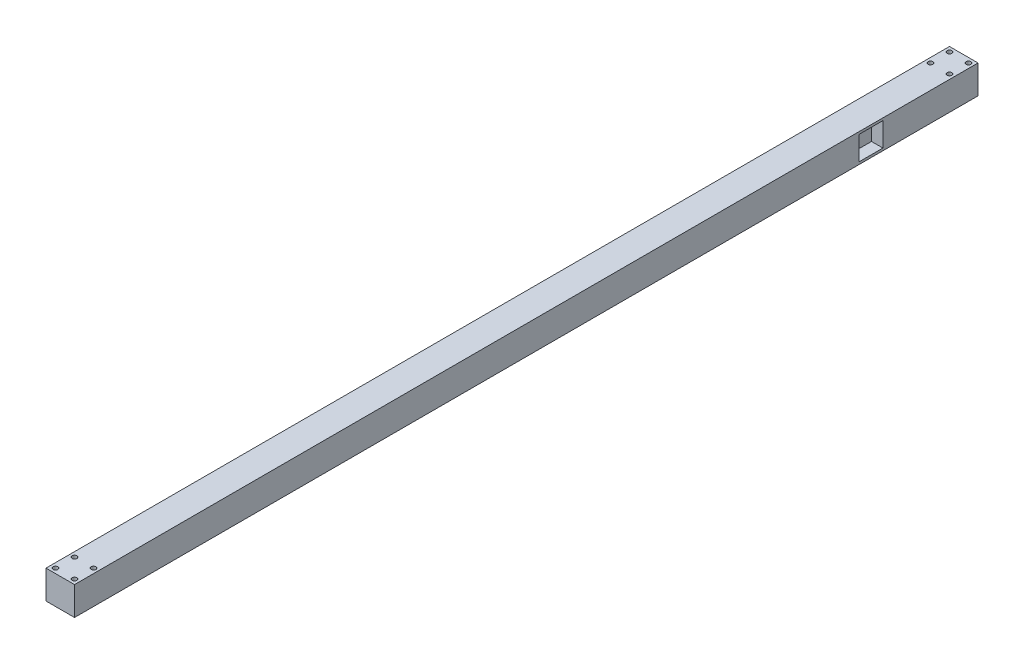
from build123d import *

# Parameters (mm, degrees)
SKETCH1_W           = 30
SKETCH1_H           = 30
BOSS_EXTRUDE1_DEPTH = 950
SKETCH2_R           = 2.5
CUT_EXTRUDE1_DEPTH  = 30
SKETCH4_W           = 25
SKETCH4_H           = 25
CUT_EXTRUDE3_DEPTH  = 12


with BuildPart() as part:
    # Sketch1 → Boss-Extrude1 (new body)
    with BuildSketch(Plane.XY):
        Rectangle(SKETCH1_W, SKETCH1_H)
    extrude(amount=BOSS_EXTRUDE1_DEPTH)

    # Sketch2 → Cut-Extrude1 (cut)
    with BuildSketch(Plane(origin=(0, 15, 0), x_dir=(1, 0, 0), z_dir=(0, 1, 0))):
        with Locations(Location((-10, -925, 0), (0, 0, 270))):
            Circle(SKETCH2_R)
        with Locations(Location((10, -925, 0), (0, 0, 270))):
            Circle(SKETCH2_R)
        with Locations(Location((10, -945, 0), (0, 0, 270))):
            Circle(SKETCH2_R)
        with Locations(Location((-10, -945, 0), (0, 0, 270))):
            Circle(SKETCH2_R)
        with Locations(Location((-10, -5, 0), (0, 0, 270))):
            Circle(SKETCH2_R)
        with Locations(Location((10, -5, 0), (0, 0, 270))):
            Circle(SKETCH2_R)
        with Locations(Location((10, -25, 0), (0, 0, 270))):
            Circle(SKETCH2_R)
        with Locations(Location((-10, -25, 0), (0, 0, 270))):
            Circle(SKETCH2_R)
    extrude(amount=-CUT_EXTRUDE1_DEPTH, mode=Mode.SUBTRACT)

    # Sketch4 → Cut-Extrude3 (cut)
    with BuildSketch(Plane(origin=(15, 0, 0), x_dir=(0, 0, -1), z_dir=(1, 0, 0))):
        with Locations((-112.5, 0)):
            Rectangle(SKETCH4_W, SKETCH4_H)
    extrude(amount=-CUT_EXTRUDE3_DEPTH, mode=Mode.SUBTRACT)


solid = part.part
